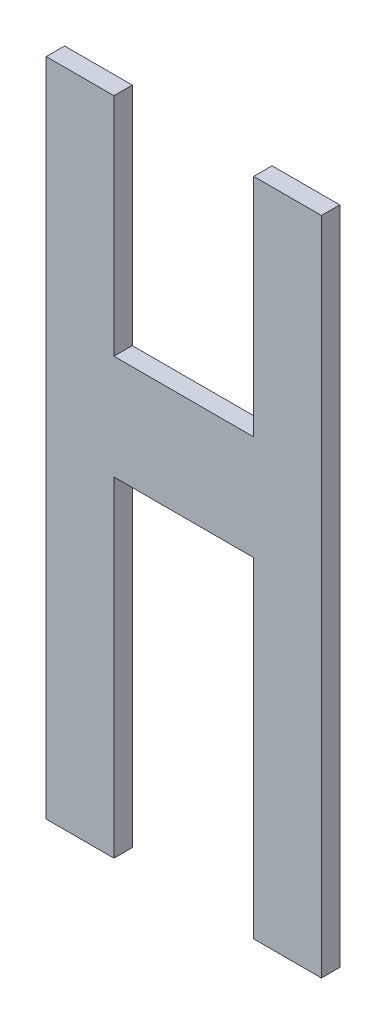
from build123d import *

# Parameters (mm, degrees)
BOSS_EXTRUDE1_DEPTH = 25.4


with BuildPart() as part:
    # Sketch1 → Boss-Extrude1 (new body)
    with BuildSketch(Plane.XY):
        Polygon((-429.514761354, 508.440170455), (-429.514761354, -405.959829545), (-335.788761354, -405.959829545), (-335.788761354, 51.240170455), (-142.284056924, 51.240170455), (-142.284056924, -405.959829545), (-48.514761354, -405.959829545), (-48.514761354, 508.440170455), (-142.284056924, 508.440170455), (-142.284056924, 196.020170455), (-335.788761354, 196.020170455), (-335.788761354, 508.440170455), align=None)
    extrude(amount=BOSS_EXTRUDE1_DEPTH)


solid = part.part
